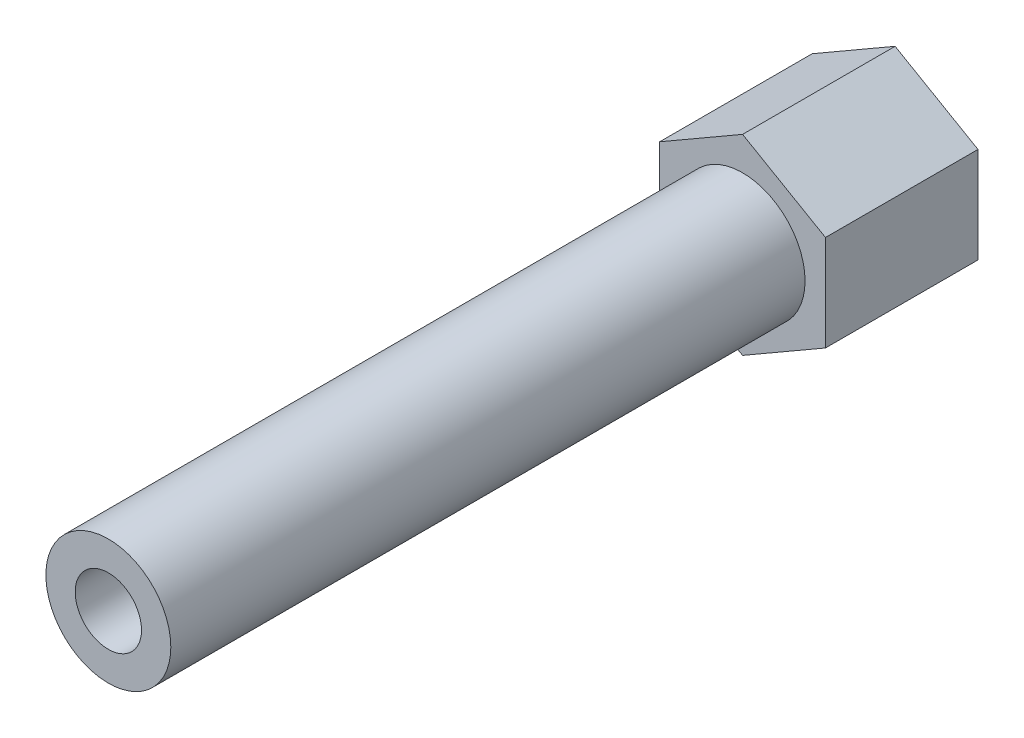
from build123d import *

# Parameters (mm, degrees)
SALIENTE_EXTRUIR1_DEPTH = 11.5
CROQUIS2_R              = 4.71
SALIENTE_EXTRUIR2_DEPTH = 47.82
CROQUIS3_R              = 2.5
CORTAR_EXTRUIR1_DEPTH   = 10


with BuildPart() as part:
    # Croquis1 → Saliente-Extruir1 (new body)
    with BuildSketch(Plane.XY):
        Polygon((0, 7.216878365), (-6.25, 3.608439182), (-6.25, -3.608439182), (0, -7.216878365), (6.25, -3.608439182), (6.25, 3.608439182), align=None)
    extrude(amount=SALIENTE_EXTRUIR1_DEPTH)

    # Croquis2 → Saliente-Extruir2 (add)
    with BuildSketch(Plane.XY.offset(11.5)):
        Circle(CROQUIS2_R)
    extrude(amount=SALIENTE_EXTRUIR2_DEPTH)

    # Croquis3 → Cortar-Extruir1 (cut)
    with BuildSketch(Plane.XY.offset(59.32)):
        Circle(CROQUIS3_R)
    extrude(amount=-CORTAR_EXTRUIR1_DEPTH, mode=Mode.SUBTRACT)


solid = part.part
